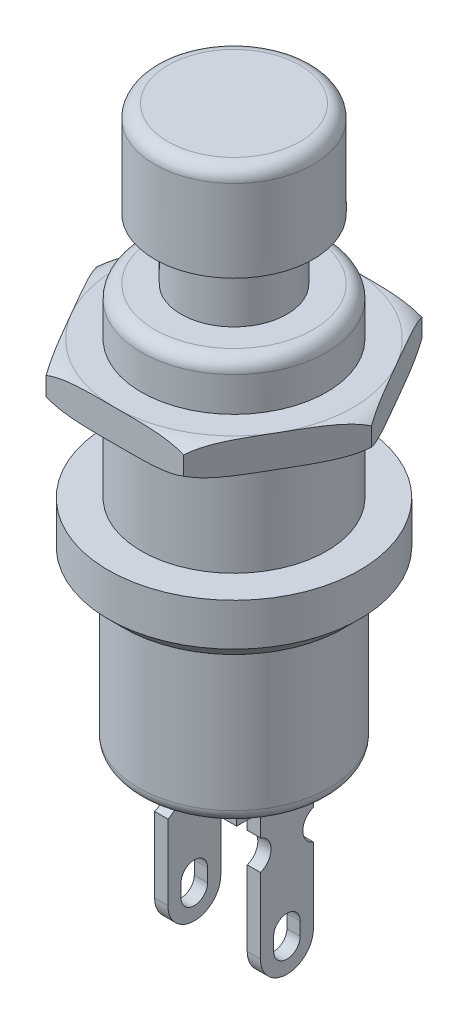
from build123d import *

# Parameters (mm, degrees)
FILLET1_R           = 0.5
BOSS_EXTRUDE1_START = 1.5
BOSS_EXTRUDE1_DEPTH = 0.5
CUT_EXTRUDE1_REACH  = 24.657
SKETCH3_R           = 0.6
BOSS_EXTRUDE2_START = 5.2
SKETCH4_R           = 3.5
BOSS_EXTRUDE2_DEPTH = 1.2


with BuildPart() as part:
    # Sketch1 → Revolve1 (revolve)
    with BuildSketch(Plane.XY, mode=Mode.PRIVATE) as revolve1_sk:
        Polygon((0, 0), (3.6, 0), (3.6, 6), (4.15, 6), (4.75, 6.6), (4.75, 8.2), (3.5, 8.2), (3.5, 15.2), (2, 15.2), (2, 17.5), (3, 17.5), (3, 21.1), (0, 21.1), align=None)
    revolve(revolve1_sk.sketch.rotate(Axis((0, 21.1, 0), (0, -1, 0)), 180), axis=Axis((0, 21.1, 0), (0, -1, 0)))

    # Fillet1
    fillet1_edges = [part.edges().sort_by_distance(p)[0] for p in [
        (3.5, 15.2, 0),
        (3.6, 0, 0),
        (3, 21.1, 0),
    ]]
    fillet(fillet1_edges, radius=FILLET1_R)

    # Sketch2 → Boss-Extrude1 (add)
    with BuildSketch(Plane(origin=(0, 0, 0), x_dir=(0, 0, -1), z_dir=(1, 0, 0)).offset(BOSS_EXTRUDE1_START)):
        with BuildLine():
            Line((-1.9, 0), (-1.9, -0.6))
            Line((-1.9, -0.6), (-1, -0.6))
            Line((-1, -0.6), (-1, -5.4))
            ThreePointArc((-1, -5.4), (0, -6.4), (1, -5.4))
            Line((1, -5.4), (1, -0.6))
            Line((1, -0.6), (1.9, -0.6))
            Line((1.9, -0.6), (1.9, 0))
            Line((1.9, 0), (-1.9, 0))
        make_face()
    boss_extrude1 = extrude(amount=BOSS_EXTRUDE1_DEPTH)

    # Sketch3 → Cut-Extrude1 (cut, up to next)
    with BuildSketch(Plane(origin=(2, 0, 0), x_dir=(0, 0, -1), z_dir=(1, 0, 0)), mode=Mode.PRIVATE) as cut_extrude1_sk1:
        with Locations((-1.2, -2)):
            Circle(SKETCH3_R)
    cut_extrude1_tool1 = extrude(cut_extrude1_sk1.sketch, amount=-CUT_EXTRUDE1_REACH, mode=Mode.PRIVATE) & part.part
    # Sketch3 → Cut-Extrude1 (cut, up to next)
    with BuildSketch(Plane(origin=(2, 0, 0), x_dir=(0, 0, -1), z_dir=(1, 0, 0)), mode=Mode.PRIVATE) as cut_extrude1_sk2:
        with Locations((1.2, -2)):
            Circle(SKETCH3_R)
    cut_extrude1_tool2 = extrude(cut_extrude1_sk2.sketch, amount=-CUT_EXTRUDE1_REACH, mode=Mode.PRIVATE) & part.part
    # Sketch3 → Cut-Extrude1 (cut, up to next)
    with BuildSketch(Plane(origin=(2, 0, 0), x_dir=(0, 0, -1), z_dir=(1, 0, 0)), mode=Mode.PRIVATE) as cut_extrude1_sk3:
        with BuildLine():
            Line((-0.5, -5.4), (-0.5, -4.9))
            ThreePointArc((-0.5, -4.9), (0, -4.4), (0.5, -4.9))
            Line((0.5, -4.9), (0.5, -5.4))
            ThreePointArc((0.5, -5.4), (0, -5.9), (-0.5, -5.4))
        make_face()
    cut_extrude1_tool3 = extrude(cut_extrude1_sk3.sketch, amount=-CUT_EXTRUDE1_REACH, mode=Mode.PRIVATE) & part.part
    cut_extrude1_1 = cut_extrude1_tool1.solids().sort_by_distance((2, -2, 1.2))[0]
    add(cut_extrude1_1, mode=Mode.SUBTRACT)
    cut_extrude1_2 = cut_extrude1_tool2.solids().sort_by_distance((2, -2, -1.2))[0]
    add(cut_extrude1_2, mode=Mode.SUBTRACT)
    cut_extrude1_3 = cut_extrude1_tool3.solids().sort_by_distance((2, -5.15, 0))[0]
    add(cut_extrude1_3, mode=Mode.SUBTRACT)
    cut_extrude1 = cut_extrude1_1 + cut_extrude1_2 + cut_extrude1_3  # Cut-Extrude1 as one shape, for the pattern or mirror that repeats it

    # Mirror1: Boss-Extrude1, Cut-Extrude1 across plane
    add(boss_extrude1.mirror(Plane(origin=(0, 0, 0), x_dir=(0, 0, 1), z_dir=(1, 0, 0))))
    add(cut_extrude1.mirror(Plane(origin=(0, 0, 0), x_dir=(0, 0, 1), z_dir=(1, 0, 0))), mode=Mode.SUBTRACT)

    # Sketch4 → Boss-Extrude2 (add)
    with BuildSketch(Plane(origin=(0, 8.2, 0), x_dir=(1, 0, 0), z_dir=(0, 1, 0)).offset(BOSS_EXTRUDE2_START)):
        Polygon((5.196152423, 0), (2.598076211, 4.5), (-2.598076211, 4.5), (-5.196152423, 0), (-2.598076211, -4.5), (2.598076211, -4.5), align=None)
        with Locations(Location((0, 0, 0), (0, 0, 180))):
            Circle(SKETCH4_R, mode=Mode.SUBTRACT)
    extrude(amount=-BOSS_EXTRUDE2_DEPTH)

    # Sketch5 → Cut-Revolve1 (revolve, cut)
    with BuildSketch(Plane.XY, mode=Mode.PRIVATE) as cut_revolve1_sk:
        with BuildLine():
            Line((-5.196152423, 13.4), (-4.5, 13.4))
            ThreePointArc((-4.5, 13.4), (-4.869840572, 13.33560525), (-5.196152423, 13.15))
            Line((-5.196152423, 13.15), (-5.196152423, 13.4))
        make_face()
        with BuildLine():
            Line((-4.5, 12.2), (-5.196152423, 12.2))
            Line((-5.196152423, 12.2), (-5.196152423, 12.45))
            ThreePointArc((-5.196152423, 12.45), (-4.869840572, 12.26439475), (-4.5, 12.2))
        make_face()
    revolve(cut_revolve1_sk.sketch.rotate(Axis((0, 13.4, 0), (0, -1, 0)), 180), axis=Axis((0, 13.4, 0), (0, -1, 0)), mode=Mode.SUBTRACT)


solid = part.part
